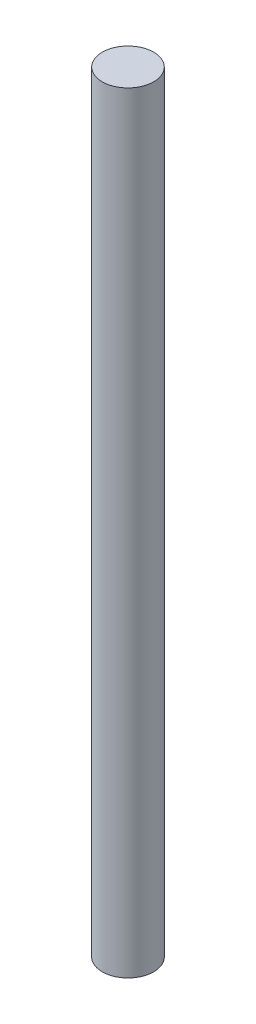
from build123d import *

# Parameters (mm, degrees)
SKETCH1_R           = 1
BOSS_EXTRUDE1_DEPTH = 30


with BuildPart() as part:
    # Sketch1 → Boss-Extrude1 (new body)
    with BuildSketch(Plane(origin=(0, 0, 0), x_dir=(1, 0, 0), z_dir=(0, 1, 0))):
        with Locations(Location((0, 0, 0), (0, 0, 270))):
            Circle(SKETCH1_R)
    extrude(amount=BOSS_EXTRUDE1_DEPTH)


solid = part.part
